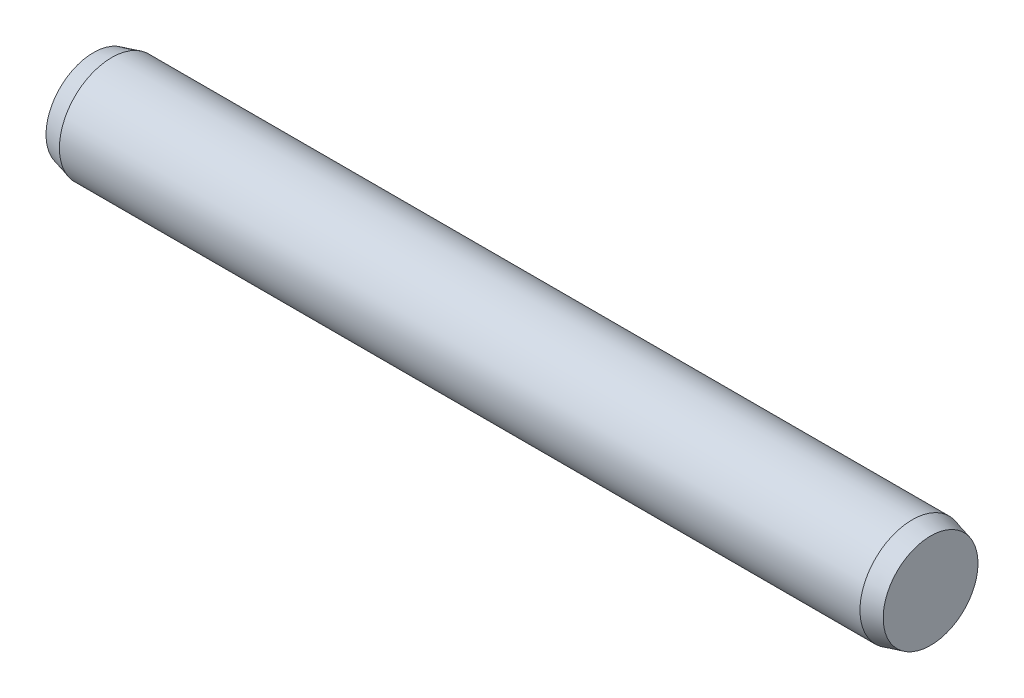
from build123d import *

# Parameters (mm, degrees)
EXTRUDE1_DEPTH      = 7.65
EXTRUDE1_DEPTH_BACK = 7.65
SKETCH2_R           = 1
SKETCH3_R           = 1
EXTRUDE2_DEPTH      = 0.35
EXTRUDE2_TAPER      = 15
SKETCH4_R           = 1
EXTRUDE3_DEPTH      = 0.35
EXTRUDE3_TAPER      = 15


with BuildPart() as part:
    # Sketch2 → Extrude1 (new, two sides: drawn at the far end of the back side and taken through both)
    with BuildSketch(Plane(origin=(0, 0, 0), x_dir=(0, 0, -1), z_dir=(1, 0, 0)).offset(-EXTRUDE1_DEPTH_BACK)):
        Circle(SKETCH2_R)
    extrude(amount=EXTRUDE1_DEPTH + EXTRUDE1_DEPTH_BACK)

    # Sketch3 → Extrude2 (add)
    with BuildSketch(Plane(origin=(7.65, 0, 0), x_dir=(0, 0, -1), z_dir=(1, 0, 0))):
        Circle(SKETCH3_R)
    extrude(amount=EXTRUDE2_DEPTH, taper=EXTRUDE2_TAPER)

    # Sketch4 → Extrude3 (add)
    with BuildSketch(Plane.ZY.offset(7.65)):
        with Locations(Location((0, 0, 0), (0, 0, 180))):
            Circle(SKETCH4_R)
    extrude(amount=EXTRUDE3_DEPTH, taper=EXTRUDE3_TAPER)


solid = part.part
